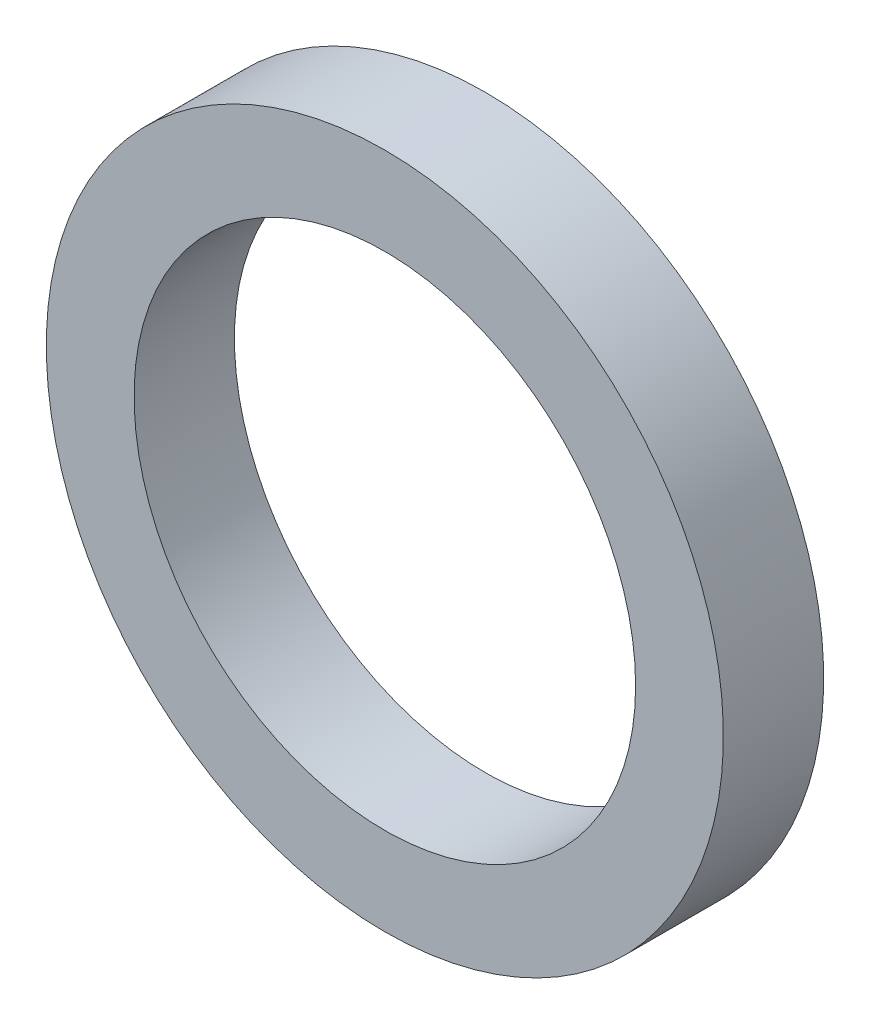
from build123d import *

# Parameters (mm, degrees)
SKETCH1_R           = 13.5
SKETCH1_R_2         = 10
EXTRUDE_THIN1_DEPTH = 4


with BuildPart() as part:
    # Sketch1 → Extrude-Thin1 (new body)
    with BuildSketch(Plane(origin=(0, 0, 0), x_dir=(0, 1, 0), z_dir=(0, 0, 1))):
        Circle(SKETCH1_R)
        Circle(SKETCH1_R_2, mode=Mode.SUBTRACT)
    extrude(amount=EXTRUDE_THIN1_DEPTH)


solid = part.part
